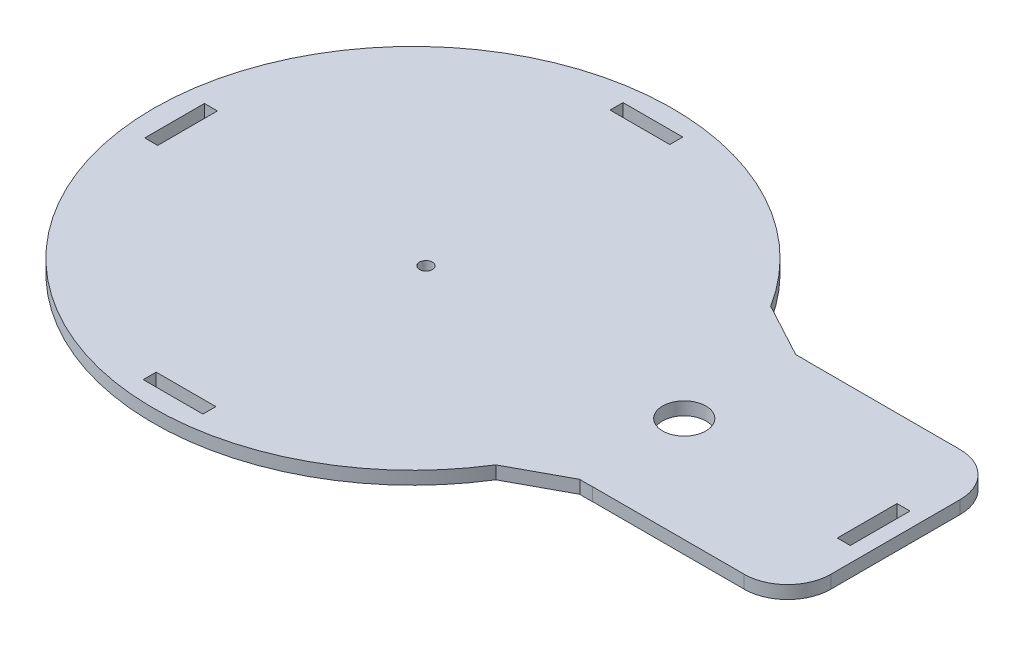
from build123d import *

# Parameters (mm, degrees)
EXTRUDE_1_DEPTH     = 3
SKETCH_3_W          = 13.8
SKETCH_3_H          = 3
SKETCH_3_W_2        = 3
SKETCH_3_H_2        = 13.8
CUT_EXTRUDE_1_DEPTH = 10
EXTRUDE_START       = -3
EXTRUDE_2_DEPTH     = 3
FILLET_1_R          = 10
SKETCH_6_W          = 3
SKETCH_6_H          = 13.8
CUT_EXTRUDE_2_DEPTH = 10
SKETCH_7_R          = 1.5
CUT_EXTRUDE_3_DEPTH = 10
SKETCH_8_R          = 5
CUT_EXTRUDE_4_DEPTH = 10


with BuildPart() as part:
    # Эскиз2 → Бобышка-Вытянуть1 (new body)
    with BuildSketch(Plane(origin=(0, 0, 0), x_dir=(1, 0, 0), z_dir=(0, 1, 0))):
        with BuildLine():
            Line((50.901300831, -31.765666587), (63.52144012, -24.956238913))
            ThreePointArc((63.52144012, -24.956238913), (90, 0), (63.52144012, 24.956238913))
            Line((63.52144012, 24.956238913), (50.901300831, 31.765666587))
            ThreePointArc((50.901300831, 31.765666587), (-60, 0), (50.901300831, -31.765666587))
        make_face()
    extrude(amount=EXTRUDE_1_DEPTH)

    # Эскиз3 → Вырез-Вытянуть1 (cut)
    with BuildSketch(Plane(origin=(0, 3, 0), x_dir=(1, 0, 0), z_dir=(0, 1, 0))):
        with Locations((0, 53.956851754)):
            Rectangle(SKETCH_3_W, SKETCH_3_H)
        with Locations((0, -53.956851754)):
            Rectangle(SKETCH_3_W, SKETCH_3_H)
        with Locations((-53.60522772, 0)):
            Rectangle(SKETCH_3_W_2, SKETCH_3_H_2)
    extrude(amount=-CUT_EXTRUDE_1_DEPTH, mode=Mode.SUBTRACT)

    # Эскиз5 → Бобышка-Вытянуть2 (add)
    with BuildSketch(Plane(origin=(0, 3, 0), x_dir=(1, 0, 0), z_dir=(0, 1, 0)).offset(EXTRUDE_START)):
        with BuildLine():
            Line((111.52144012, 24.956238913), (66.47855988, 24.956238913))
            ThreePointArc((66.47855988, 24.956238913), (90, 0), (66.47855988, -24.956238913))
            Line((66.47855988, -24.956238913), (111.52144012, -24.956238913))
            Line((111.52144012, -24.956238913), (111.52144012, 24.956238913))
        make_face()
    extrude(amount=EXTRUDE_2_DEPTH)

    # Скругление1
    fillet_1_edges = [part.edges().sort_by_distance(p)[0] for p in [
        (111.52144012, 1.5, 24.956238913),
        (111.52144012, 1.5, -24.956238913),
    ]]
    fillet(fillet_1_edges, radius=FILLET_1_R)

    # Эскиз6 → Вырез-Вытянуть2 (cut)
    with BuildSketch(Plane(origin=(0, 3, 0), x_dir=(1, 0, 0), z_dir=(0, 1, 0))):
        with Locations((106.52144012, -0.043761087)):
            Rectangle(SKETCH_6_W, SKETCH_6_H)
    extrude(amount=-CUT_EXTRUDE_2_DEPTH, mode=Mode.SUBTRACT)

    # Эскиз7 → Вырез-Вытянуть3 (cut)
    with BuildSketch(Plane(origin=(0, 3, 0), x_dir=(1, 0, 0), z_dir=(0, 1, 0))):
        with Locations(Location((3, 0, 0), (0, 0, 270))):
            Circle(SKETCH_7_R)
    extrude(amount=-CUT_EXTRUDE_3_DEPTH, mode=Mode.SUBTRACT)

    # Эскиз8 → Вырез-Вытянуть4 (cut)
    with BuildSketch(Plane(origin=(0, 3, 0), x_dir=(1, 0, 0), z_dir=(0, 1, 0))):
        with Locations(Location((63.40144012, -0.703761087, 0), (0, 0, 270))):
            Circle(SKETCH_8_R)
    extrude(amount=-CUT_EXTRUDE_4_DEPTH, mode=Mode.SUBTRACT)


solid = part.part
